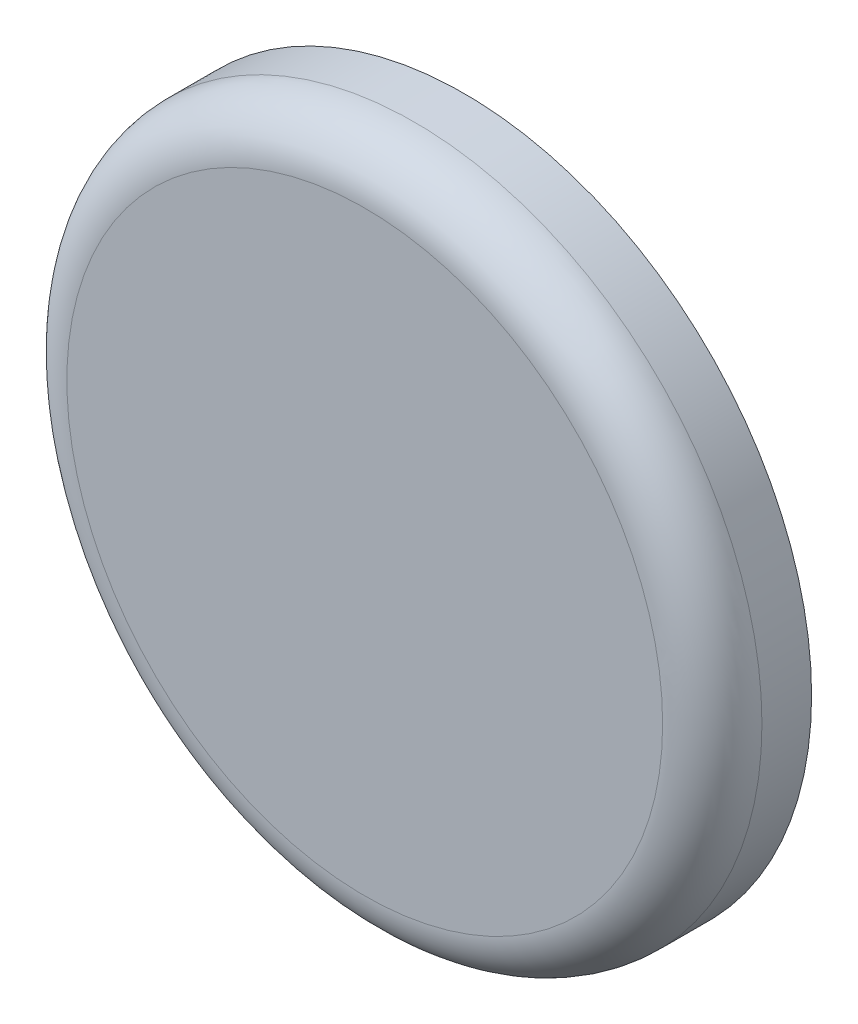
from build123d import *

# Parameters (mm, degrees)
SKETCH_1_R      = 7
EXTRUDE_1_DEPTH = 2
FILLET_1_R      = 1


with BuildPart() as part:
    # Эскиз1 → Бобышка-Вытянуть1 (new body)
    with BuildSketch(Plane.XY):
        Circle(SKETCH_1_R)
    extrude(amount=EXTRUDE_1_DEPTH)

    # Скругление1
    fillet_1_edges = [part.edges().sort_by_distance(p)[0] for p in [
        (-7, 0, 2),
    ]]
    fillet(fillet_1_edges, radius=FILLET_1_R)


solid = part.part
